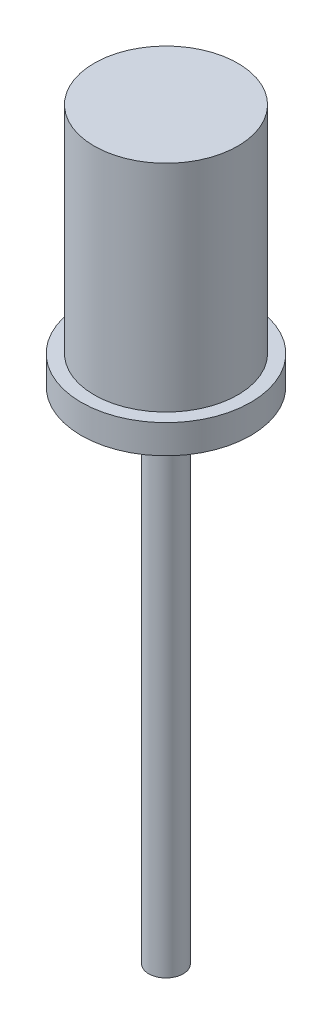
from build123d import *

# Parameters (mm, degrees)
SKETCH1_R           = 2.95
BOSS_EXTRUDE1_DEPTH = 1
SKETCH2_R           = 2.5
BOSS_EXTRUDE2_DEPTH = 7.5
SKETCH3_R           = 0.6
BOSS_EXTRUDE3_DEPTH = 17.4


with BuildPart() as part:
    # Sketch1 → Boss-Extrude1 (new body)
    with BuildSketch(Plane(origin=(0, 0, 0), x_dir=(1, 0, 0), z_dir=(0, 1, 0))):
        with Locations(Location((0, 0, 0), (0, 0, 270))):
            Circle(SKETCH1_R)
    extrude(amount=BOSS_EXTRUDE1_DEPTH)

    # Sketch2 → Boss-Extrude2 (add)
    with BuildSketch(Plane(origin=(0, 1, 0), x_dir=(1, 0, 0), z_dir=(0, 1, 0))):
        with Locations(Location((0, 0, 0), (0, 0, 270))):
            Circle(SKETCH2_R)
    extrude(amount=BOSS_EXTRUDE2_DEPTH)

    # Sketch3 → Boss-Extrude3 (add)
    with BuildSketch(Plane.XZ):
        with Locations(Location((0, 0, 0), (0, 0, 270))):
            Circle(SKETCH3_R)
    extrude(amount=BOSS_EXTRUDE3_DEPTH)


solid = part.part
